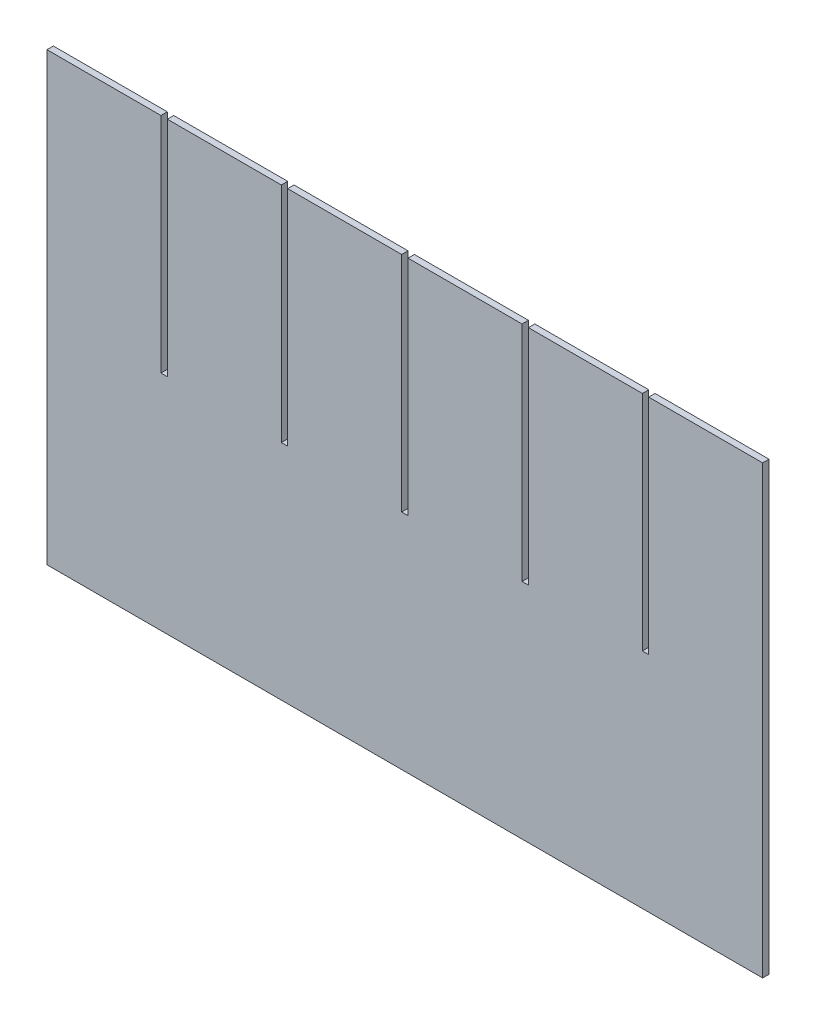
from build123d import *

# Parameters (mm, degrees)
SKETCH1_W           = 224.6
SKETCH1_H           = 140
BOSS_EXTRUDE1_DEPTH = 2
SKETCH2_W           = 2
SKETCH2_H           = 70
CUT_EXTRUDE3_DEPTH  = 133.345343704


with BuildPart() as part:
    # Sketch1 → Boss-Extrude1 (new body)
    with BuildSketch(Plane.XY):
        Rectangle(SKETCH1_W, SKETCH1_H)
    extrude(amount=BOSS_EXTRUDE1_DEPTH)

    # Sketch2 → Cut-Extrude3 (cut, through all)
    with BuildSketch(Plane.XY.offset(2)):
        with Locations((-75.53, 35)):
            Rectangle(SKETCH2_W, SKETCH2_H)
        with Locations((-37.76, 35)):
            Rectangle(SKETCH2_W, SKETCH2_H)
        with Locations((0.01, 35)):
            Rectangle(SKETCH2_W, SKETCH2_H)
        with Locations((75.55, 35)):
            Rectangle(SKETCH2_W, SKETCH2_H)
        with Locations((37.78, 35)):
            Rectangle(SKETCH2_W, SKETCH2_H)
    extrude(amount=-CUT_EXTRUDE3_DEPTH, mode=Mode.SUBTRACT)


solid = part.part
